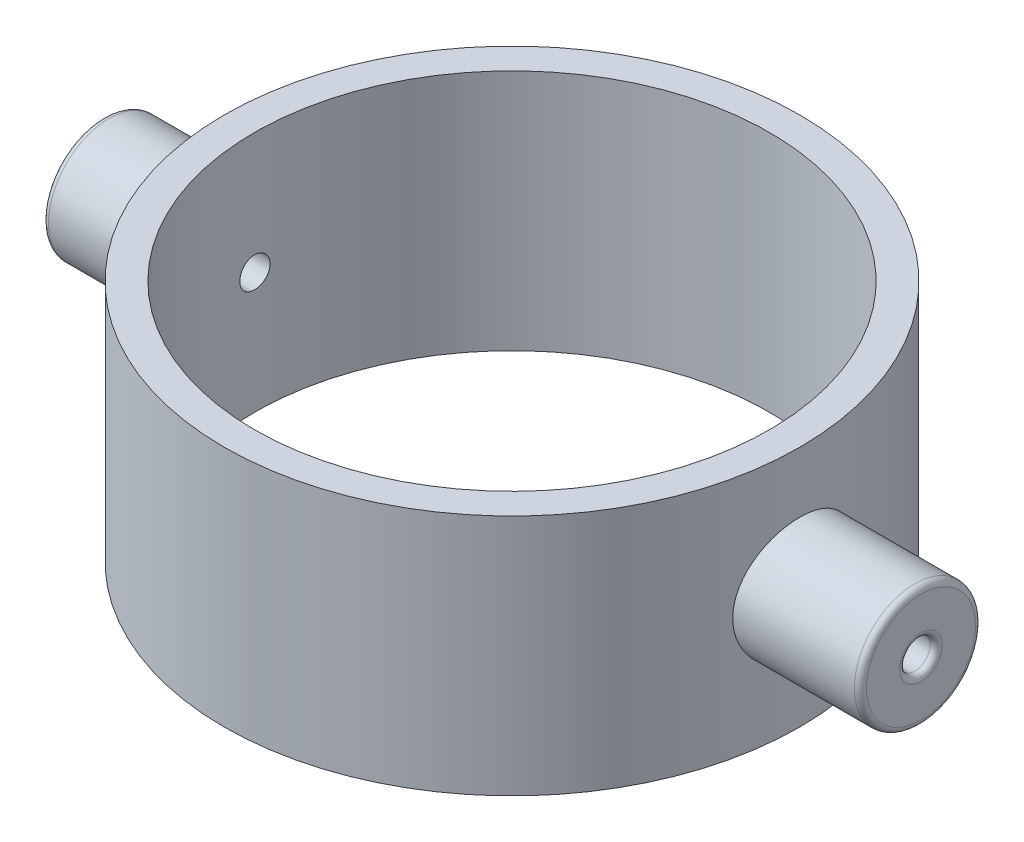
from build123d import *

# Parameters (mm, degrees)
SKETCH1_R           = 60.325
SKETCH1_R_2         = 53.975
BOSS_EXTRUDE1_DEPTH = 50.8
BOSS_EXTRUDE2_START = -1.351993
SKETCH2_R           = 12.7
BOSS_EXTRUDE2_DEPTH = 26.751993
SKETCH3_R           = 3.175
CUT_EXTRUDE1_DEPTH  = 50.8
FILLET1_R           = 1.27


with BuildPart() as part:
    # Sketch1 → Boss-Extrude1 (new body)
    with BuildSketch(Plane(origin=(0, 0, 0), x_dir=(1, 0, 0), z_dir=(0, 1, 0))):
        with Locations(Location((0, 0, 0), (0, 0, 270))):
            Circle(SKETCH1_R)
        with Locations(Location((0, 0, 0), (0, 0, 270))):
            Circle(SKETCH1_R_2, mode=Mode.SUBTRACT)
    extrude(amount=BOSS_EXTRUDE1_DEPTH)

    # Sketch2 → Boss-Extrude2 (add)
    with BuildSketch(Plane.ZY.offset(60.325).offset(BOSS_EXTRUDE2_START)):
        with Locations(Location((0, 25.4, 0), (0, 0, 180))):
            Circle(SKETCH2_R)
    boss_extrude2 = extrude(amount=BOSS_EXTRUDE2_DEPTH)

    # Sketch3 → Cut-Extrude1 (cut)
    with BuildSketch(Plane.ZY.offset(85.725)):
        with Locations((0, 25.4)):
            Circle(SKETCH3_R)
    cut_extrude1 = extrude(amount=-CUT_EXTRUDE1_DEPTH, mode=Mode.SUBTRACT)

    # Mirror1: Boss-Extrude2, Cut-Extrude1 across plane
    add(boss_extrude2.mirror(Plane(origin=(0, 0, 0), x_dir=(0, 0, 1), z_dir=(1, 0, 0))))
    add(cut_extrude1.mirror(Plane(origin=(0, 0, 0), x_dir=(0, 0, 1), z_dir=(1, 0, 0))), mode=Mode.SUBTRACT)

    # Fillet1
    fillet1_edges = [part.edges().sort_by_distance(p)[0] for p in [
        (-85.725, 25.4, 12.7),
        (-85.725, 25.4, -3.175),
        (85.725, 25.4, 12.7),
        (85.725, 25.4, -3.175),
    ]]
    fillet(fillet1_edges, radius=FILLET1_R)


solid = part.part
